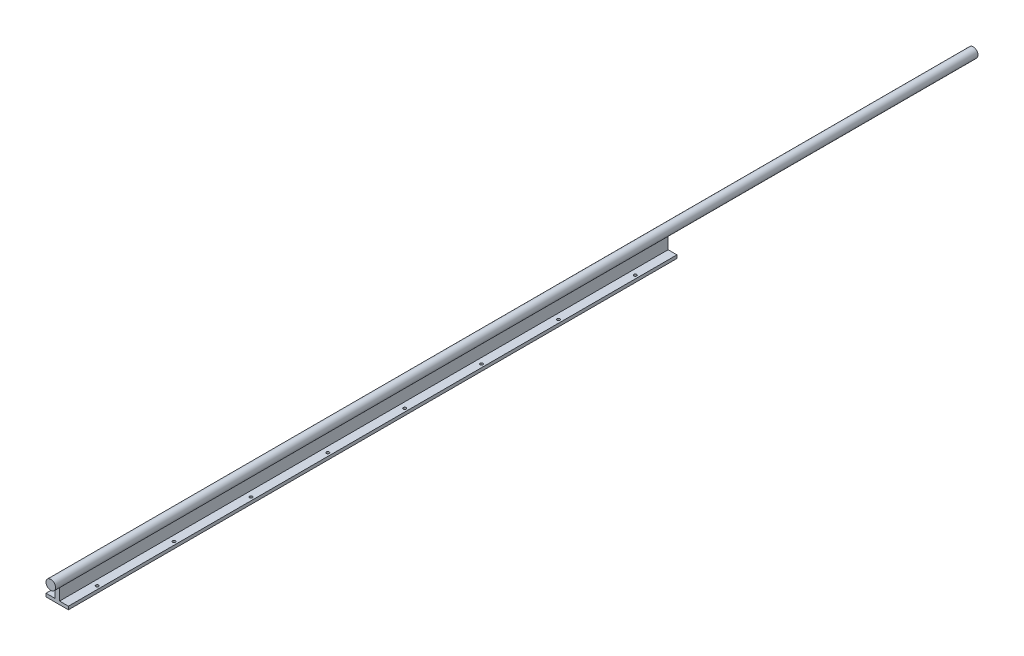
from build123d import *
from build123d.topology import SkipClean

# Parameters (mm, degrees)
EXTRUDE1_DEPTH         = 1219.2
F_10_CLEARANCE_HOLE1_D = 5.6134
LPATTERN3_COUNT        = 8
LPATTERN3_PITCH        = 152.4
SKETCH4_OUTSIDE_W      = 290.638
SKETCH4_OUTSIDE_H      = 293.813
SKETCH4_OUTSIDE_R      = 9.525
CUT_EXTRUDE1_DEPTH     = 12.7
EXTRUDE2_START         = 609.6
SKETCH5_R              = 9.525
EXTRUDE2_DEPTH         = 609.6


with BuildPart() as part:
    # Sketch1 → Extrude1 (new body)
    with BuildSketch(Plane.XY):
        with BuildLine():
            Line((-22.225, -38.1), (22.225, -38.1))
            Line((22.225, -38.1), (22.225, -31.75))
            Line((22.225, -31.75), (4.7625, -31.75))
            Line((4.7625, -31.75), (4.7625, -8.248891971))
            ThreePointArc((4.7625, -8.248891971), (0, 9.525), (-4.7625, -8.248891971))
            Line((-4.7625, -8.248891971), (-4.7625, -31.75))
            Line((-4.7625, -31.75), (-22.225, -31.75))
            Line((-22.225, -31.75), (-22.225, -38.1))
        make_face()
    extrude(amount=EXTRUDE1_DEPTH)

    # #10 Clearance Hole1 (through all)
    with Locations(Plane.XZ.offset(38.1)):
        with Locations((-15.875, 76.2), (15.875, 76.2)):
            f_10_clearance_hole1 = Hole(F_10_CLEARANCE_HOLE1_D / 2)

    # LPattern3: #10 Clearance Hole1 ×8
    with Locations(*[(0, 0, i * LPATTERN3_PITCH) for i in range(1, LPATTERN3_COUNT)]):
        add(f_10_clearance_hole1, mode=Mode.SUBTRACT)

    # Sketch4 outside → Cut-Extrude1 (cut)
    with BuildSketch(Plane.XY.offset(1219.2)):
        with Locations((0, -14.2875)):
            Rectangle(SKETCH4_OUTSIDE_W, SKETCH4_OUTSIDE_H)
        with Locations(Location((0, 0, 0), (0, 0, 240))):
            Circle(SKETCH4_OUTSIDE_R, mode=Mode.SUBTRACT)
    extrude(amount=-CUT_EXTRUDE1_DEPTH, mode=Mode.SUBTRACT)

    # Sketch5 → Extrude2 (add)
    with SkipClean():  # the faces are left unmerged after this step: merging them gives an invalid solid
        with BuildSketch(Plane(origin=(0, 0, 0), x_dir=(-1, 0, 0), z_dir=(0, 0, -1)).offset(EXTRUDE2_START)):
            Circle(SKETCH5_R)
        extrude(amount=-EXTRUDE2_DEPTH)


solid = part.part
